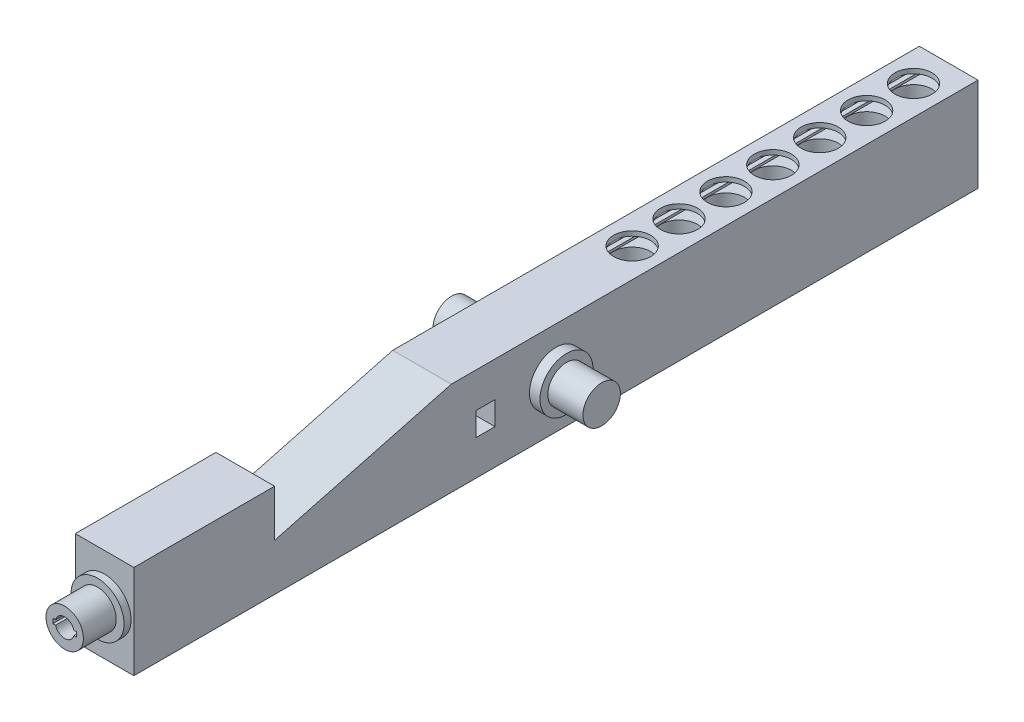
from build123d import *

# Parameters (mm, degrees)
SKETCH1_W           = 12.5
SKETCH1_H           = 180
BOSS_EXTRUDE1_DEPTH = 20
SKETCH2_R           = 5.65
BOSS_EXTRUDE2_DEPTH = 1.5
SKETCH3_R           = 3.99
BOSS_EXTRUDE3_DEPTH = 7
SKETCH4_R           = 5.65
BOSS_EXTRUDE4_DEPTH = 2.25
SKETCH5_R           = 3.99
BOSS_EXTRUDE5_DEPTH = 7.5
BOSS_EXTRUDE6_START = 2.25
SKETCH6_R           = 5.65
BOSS_EXTRUDE6_DEPTH = 2.25
BOSS_EXTRUDE7_START = 7.5
SKETCH7_R           = 3.99
BOSS_EXTRUDE7_DEPTH = 7.5
SKETCH8_R           = 3.95
CUT_EXTRUDE1_DEPTH  = 19
SKETCH9_W           = 8
SKETCH9_H           = 2
CUT_EXTRUDE2_DEPTH  = 72.5
SKETCH10_W          = 11.5
SKETCH10_H          = 1
CUT_EXTRUDE3_DEPTH  = 72.5
CUT_EXTRUDE5_DEPTH  = 20
SKETCH14_W          = 4
SKETCH14_H          = 5
CUT_EXTRUDE6_DEPTH  = 12.5
CUT_EXTRUDE7_REACH  = 104.943


with BuildPart() as part:
    # Sketch1 → Boss-Extrude1 (new body)
    with BuildSketch(Plane(origin=(0, 0, 0), x_dir=(1, 0, 0), z_dir=(0, 1, 0))):
        Rectangle(SKETCH1_W, SKETCH1_H)
    extrude(amount=BOSS_EXTRUDE1_DEPTH)

    # Sketch2 → Boss-Extrude2 (add)
    with BuildSketch(Plane.XY.offset(90)):
        with Locations(Location((0, 10, 0), (0, 0, 180))):
            Circle(SKETCH2_R)
    extrude(amount=BOSS_EXTRUDE2_DEPTH)

    # Sketch3 → Boss-Extrude3 (add)
    with BuildSketch(Plane.XY.offset(91.5)):
        with Locations(Location((0, 10, 0), (0, 0, 180))):
            Circle(SKETCH3_R)
    extrude(amount=BOSS_EXTRUDE3_DEPTH)

    # Sketch4 → Boss-Extrude4 (add)
    with BuildSketch(Plane.ZY.offset(6.25)):
        with Locations(Location((0, 10, 0), (0, 0, 180))):
            Circle(SKETCH4_R)
    extrude(amount=BOSS_EXTRUDE4_DEPTH)

    # Sketch5 → Boss-Extrude5 (add)
    with BuildSketch(Plane.ZY.offset(8.5)):
        with Locations((0, 10)):
            Circle(SKETCH5_R)
    extrude(amount=BOSS_EXTRUDE5_DEPTH)

    # Sketch6 → Boss-Extrude6 (add)
    with BuildSketch(Plane(origin=(6.25, 0, 0), x_dir=(0, 0, -1), z_dir=(1, 0, 0)).offset(BOSS_EXTRUDE6_START)):
        with Locations((0, 10)):
            Circle(SKETCH6_R)
    extrude(amount=-BOSS_EXTRUDE6_DEPTH)

    # Sketch7 → Boss-Extrude7 (add)
    with BuildSketch(Plane(origin=(8.5, 0, 0), x_dir=(0, 0, -1), z_dir=(1, 0, 0)).offset(BOSS_EXTRUDE7_START)):
        with Locations(Location((0, 10, 0), (0, 0, 180))):
            Circle(SKETCH7_R)
    extrude(amount=-BOSS_EXTRUDE7_DEPTH)

    # Sketch8 → Cut-Extrude1 (cut)
    with BuildSketch(Plane(origin=(0, 20, 0), x_dir=(1, 0, 0), z_dir=(0, 1, 0))):
        with Locations(Location((0, 82.5, 0), (0, 0, 270))):
            Circle(SKETCH8_R)
        with Locations(Location((0, 72.5, 0), (0, 0, 270))):
            Circle(SKETCH8_R)
        with Locations(Location((0, 62.5, 0), (0, 0, 270))):
            Circle(SKETCH8_R)
        with Locations(Location((0, 52.5, 0), (0, 0, 270))):
            Circle(SKETCH8_R)
        with Locations(Location((0, 42.5, 0), (0, 0, 270))):
            Circle(SKETCH8_R)
        with Locations(Location((0, 32.5, 0), (0, 0, 270))):
            Circle(SKETCH8_R)
        with Locations(Location((0, 22.5, 0), (0, 0, 270))):
            Circle(SKETCH8_R)
    extrude(amount=-CUT_EXTRUDE1_DEPTH, mode=Mode.SUBTRACT)

    # Sketch9 → Cut-Extrude2 (cut)
    with BuildSketch(Plane(origin=(0, 0, -90), x_dir=(-1, 0, 0), z_dir=(0, 0, -1))):
        with Locations((0, 18)):
            Rectangle(SKETCH9_W, SKETCH9_H)
    extrude(amount=-CUT_EXTRUDE2_DEPTH, mode=Mode.SUBTRACT)

    # Sketch10 → Cut-Extrude3 (cut)
    with BuildSketch(Plane(origin=(0, 0, -90), x_dir=(-1, 0, 0), z_dir=(0, 0, -1))):
        with Locations((0, 18)):
            Rectangle(SKETCH10_W, SKETCH10_H)
    extrude(amount=-CUT_EXTRUDE3_DEPTH, mode=Mode.SUBTRACT)

    # Sketch12 → Cut-Extrude5 (cut)
    with BuildSketch(Plane.XY.offset(98.5)):
        with BuildLine():
            Line((1.936491673, 10.5), (2.5, 10.5))
            Line((2.5, 10.5), (2.5, 9.5))
            Line((2.5, 9.5), (1.936491673, 9.5))
            ThreePointArc((1.936491673, 9.5), (0, 8), (-1.936491673, 9.5))
            Line((-1.936491673, 9.5), (-2.5, 9.5))
            Line((-2.5, 9.5), (-2.5, 10.5))
            Line((-2.5, 10.5), (-1.936491673, 10.5))
            ThreePointArc((-1.936491673, 10.5), (0, 12), (1.936491673, 10.5))
        make_face()
    extrude(amount=-CUT_EXTRUDE5_DEPTH, mode=Mode.SUBTRACT)

    # Sketch14 → Cut-Extrude6 (cut)
    with BuildSketch(Plane(origin=(6.25, 0, 0), x_dir=(0, 0, -1), z_dir=(1, 0, 0))):
        with Locations((-15, 10)):
            Rectangle(SKETCH14_W, SKETCH14_H)
    extrude(amount=-CUT_EXTRUDE6_DEPTH, mode=Mode.SUBTRACT)

    # Sketch15 → Cut-Extrude7 (cut, up to next)
    with BuildSketch(Plane(origin=(6.25, 0, 0), x_dir=(0, 0, -1), z_dir=(1, 0, 0)), mode=Mode.PRIVATE) as cut_extrude7_sk1:
        Polygon((-60, 10), (-60, 20), (-22.30384635, 20), align=None)
    cut_extrude7_tool1 = extrude(cut_extrude7_sk1.sketch, amount=-CUT_EXTRUDE7_REACH, mode=Mode.PRIVATE) & part.part
    add(cut_extrude7_tool1.solids().sort_by_distance((6.25, 16.666667, 47.434615))[0], mode=Mode.SUBTRACT)


solid = part.part
